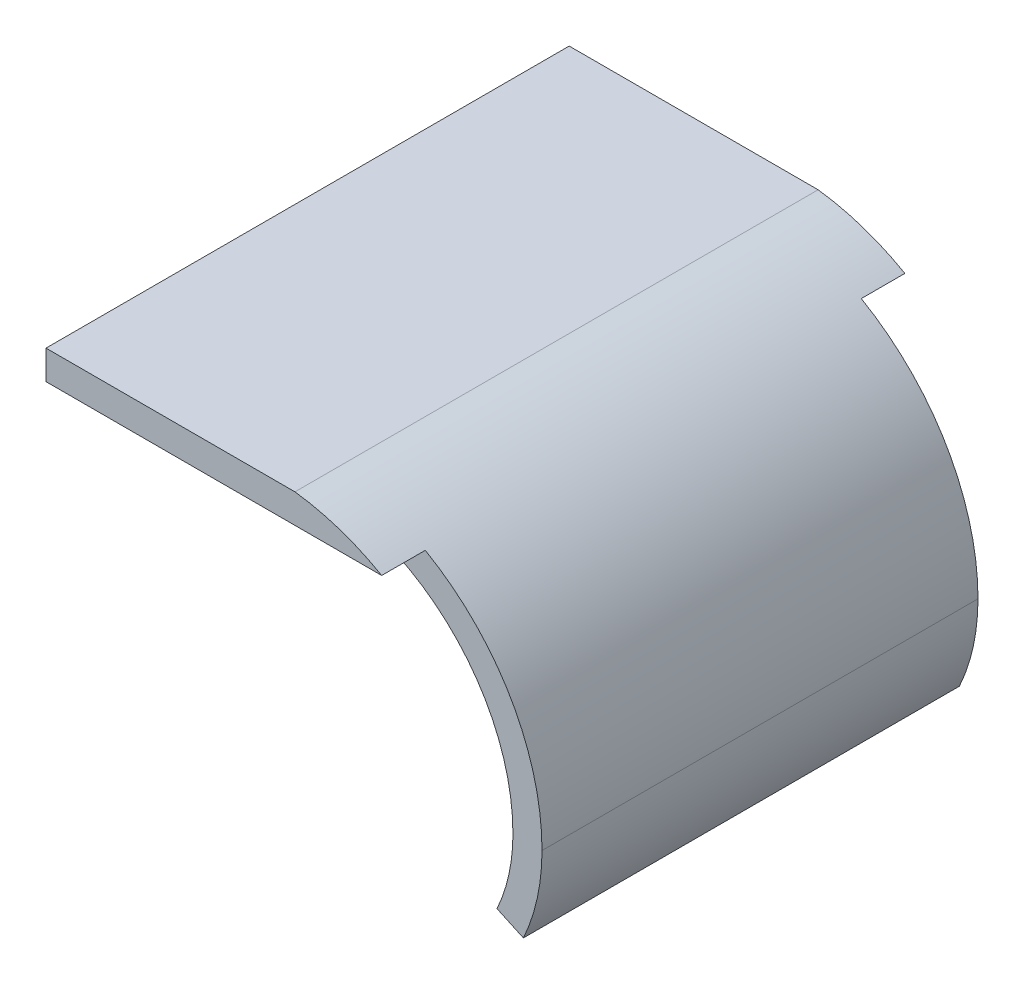
from build123d import *

# Parameters (mm, degrees)
BOSS_EXTRUDE1_DEPTH = 9
CUT_EXTRUDE1_DEPTH  = 1.5


with BuildPart() as part:
    # Sketch1 → Boss-Extrude1 (new, symmetric)
    with BuildSketch(Plane.XY):
        with BuildLine():
            Line((-0.064848747, 6.937253933), (-8.564848747, 6.937253933))
            Line((-8.564848747, 6.937253933), (-8.564848747, 7.937253933))
            Line((-8.564848747, 7.937253933), (0, 7.937253933))
            ThreePointArc((0, 7.937253933), (5, 5.291502622), (7, 0))
            ThreePointArc((7, 0), (6.838022738, -1.497145631), (6.359587132, -2.925004532))
            Line((6.359587132, -2.925004532), (5.451074684, -2.507146742))
            ThreePointArc((5.451074684, -2.507146742), (5.861162347, -1.283267683), (6, 0))
            ThreePointArc((6, 0), (4.270012276, 4.607273664), (-0.064848747, 6.937253933))
        make_face()
    extrude(amount=BOSS_EXTRUDE1_DEPTH, both=True)

    # Sketch2 → Cut-Extrude1 (cut)
    with BuildSketch(Plane.XY.offset(9)):
        with BuildLine():
            Line((5.451074684, -2.507146742), (6.359587132, -2.925004532))
            ThreePointArc((6.359587132, -2.925004532), (6.838022738, -1.497145631), (7, 0))
            ThreePointArc((7, 0), (5.923664522, 4.007850993), (2.984282604, 6.937253933))
            Line((2.984282604, 6.937253933), (-0.064848747, 6.937253933))
            ThreePointArc((-0.064848747, 6.937253933), (4.270012276, 4.607273664), (6, 0))
            ThreePointArc((6, 0), (5.861162347, -1.283267683), (5.451074684, -2.507146742))
        make_face()
    cut_extrude1 = extrude(amount=-CUT_EXTRUDE1_DEPTH, mode=Mode.SUBTRACT)

    # Mirror1: Cut-Extrude1 across plane
    add(cut_extrude1.mirror(Plane.XY), mode=Mode.SUBTRACT)


solid = part.part
